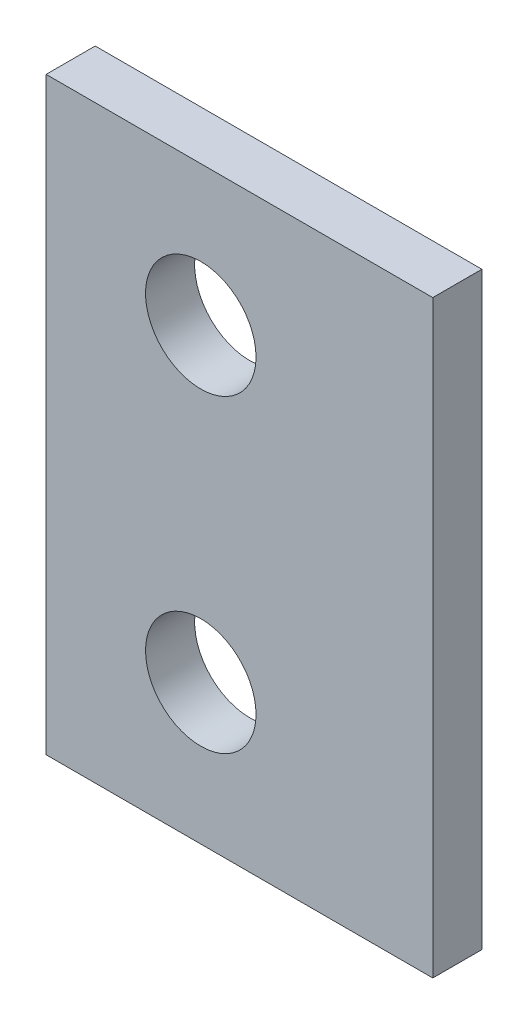
from build123d import *

# Parameters (mm, degrees)
CROQUIS1_W              = 50
CROQUIS1_H              = 76.2
SALIENTE_EXTRUIR1_DEPTH = 6.35
CROQUIS2_R              = 7.14375
CORTAR_EXTRUIR1_DEPTH   = 10


with BuildPart() as part:
    # Croquis1 → Saliente-Extruir1 (new body)
    with BuildSketch(Plane.XY):
        with Locations((25, -38.1)):
            Rectangle(CROQUIS1_W, CROQUIS1_H)
    extrude(amount=SALIENTE_EXTRUIR1_DEPTH)

    # Croquis2 → Cortar-Extruir1 (cut)
    with BuildSketch(Plane.XY.offset(6.35)):
        with Locations((20, -18.1)):
            Circle(CROQUIS2_R)
        with Locations((20, -58.1)):
            Circle(CROQUIS2_R)
    extrude(amount=-CORTAR_EXTRUIR1_DEPTH, mode=Mode.SUBTRACT)


solid = part.part
